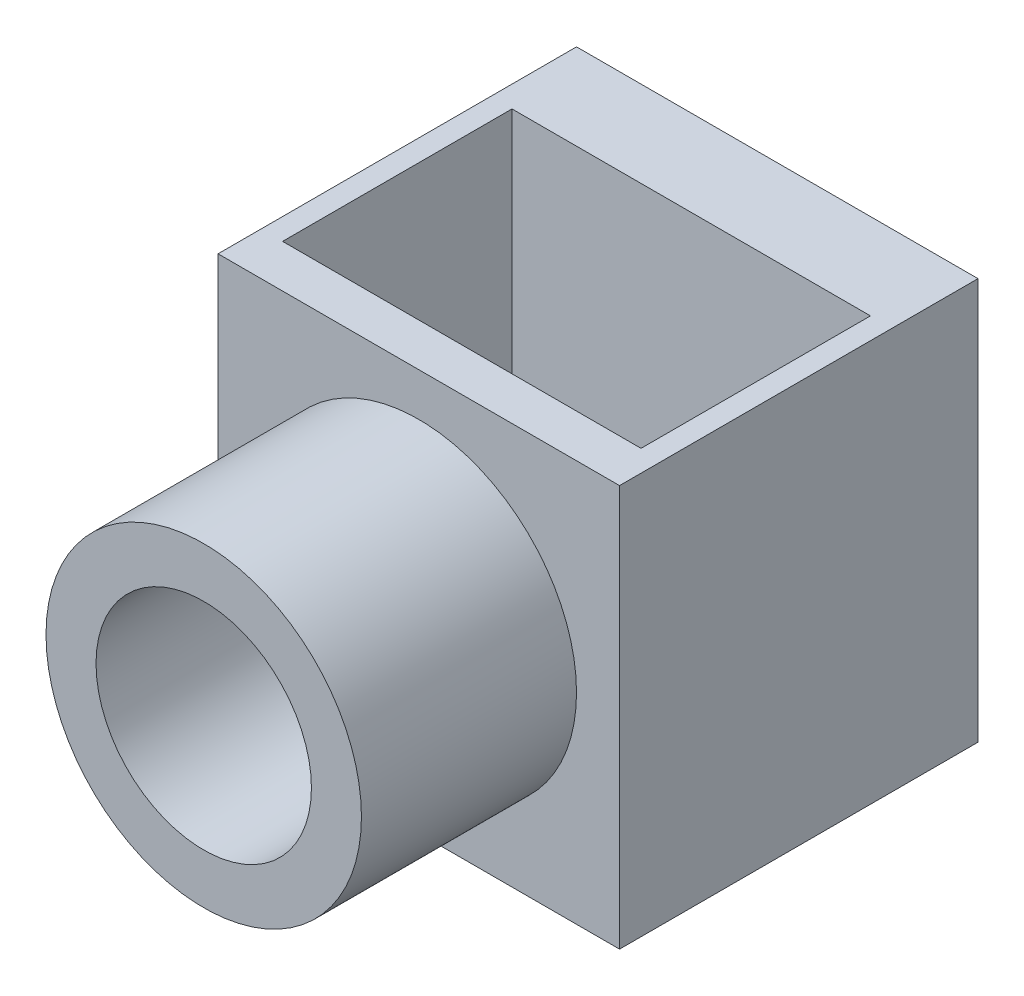
from build123d import *

# Parameters (mm, degrees)
SKETCH1_W           = 7.112
SKETCH1_H           = 6.35
BOSS_EXTRUDE1_DEPTH = 7.112
SKETCH2_R           = 2.286
CUT_EXTRUDE1_DEPTH  = 1.27
SKETCH3_W           = 6.35
SKETCH3_H           = 4.064
CUT_EXTRUDE2_DEPTH  = 6.35
SKETCH4_R           = 2.794
BOSS_EXTRUDE2_DEPTH = 3.81
SKETCH6_R           = 1.907980072
CUT_EXTRUDE3_DEPTH  = 3.81


with BuildPart() as part:
    # Sketch1 → Boss-Extrude1 (new body)
    with BuildSketch(Plane(origin=(0, 0, 0), x_dir=(1, 0, 0), z_dir=(0, 1, 0))):
        with Locations((3.556, 3.175)):
            Rectangle(SKETCH1_W, SKETCH1_H)
    extrude(amount=BOSS_EXTRUDE1_DEPTH)

    # Sketch2 → Cut-Extrude1 (cut)
    with BuildSketch(Plane.XY):
        with Locations((3.556, 3.556)):
            Circle(SKETCH2_R)
    extrude(amount=-CUT_EXTRUDE1_DEPTH, mode=Mode.SUBTRACT)

    # Sketch3 → Cut-Extrude2 (cut)
    with BuildSketch(Plane(origin=(0, 7.112, 0), x_dir=(1, 0, 0), z_dir=(0, 1, 0))):
        with Locations((3.556, 2.794)):
            Rectangle(SKETCH3_W, SKETCH3_H)
    extrude(amount=-CUT_EXTRUDE2_DEPTH, mode=Mode.SUBTRACT)

    # Sketch4 → Boss-Extrude2 (add)
    with BuildSketch(Plane.XY):
        with Locations(Location((3.556, 3.556, 0), (0, 0, 180))):
            Circle(SKETCH4_R)
    extrude(amount=BOSS_EXTRUDE2_DEPTH)

    # Sketch6 → Cut-Extrude3 (cut)
    with BuildSketch(Plane.XY.offset(3.81)):
        with Locations((3.556, 3.556)):
            Circle(SKETCH6_R)
    extrude(amount=-CUT_EXTRUDE3_DEPTH, mode=Mode.SUBTRACT)


solid = part.part
